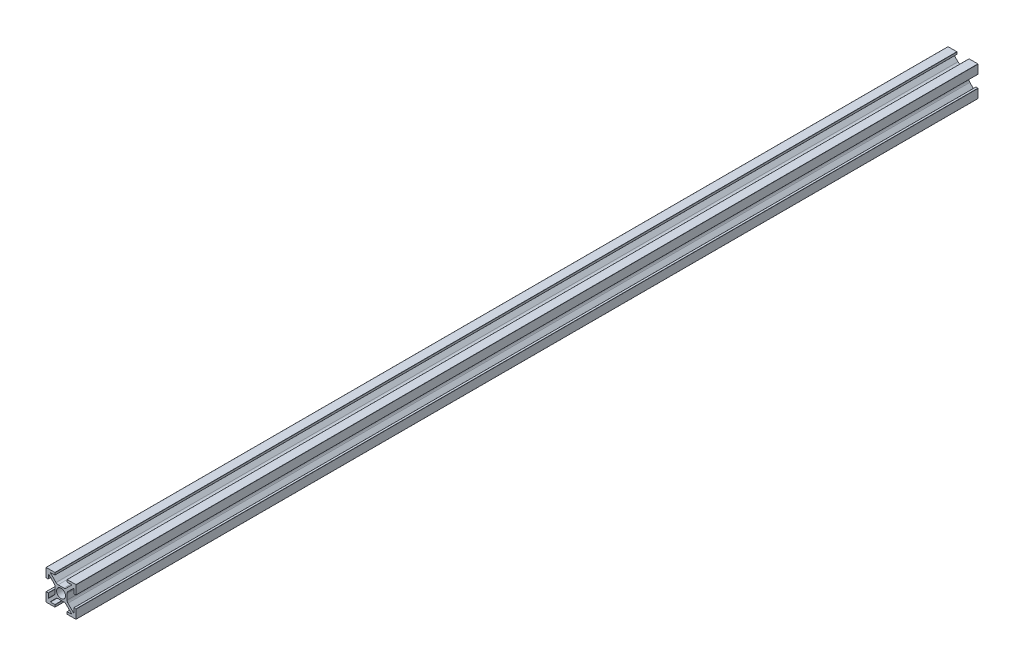
from build123d import *

# Parameters (mm, degrees)
SKETCH1_R           = 3
BOSS_EXTRUDE2_DEPTH = 600


with BuildPart() as part:
    # Sketch1 → Boss-Extrude2 (new body)
    with BuildSketch(Plane.XY.offset(60)):
        with BuildLine():
            Line((18.5, 17.008578644), (18.5, 14.1))
            ThreePointArc((18.5, 14.1), (18.529289322, 14.029289322), (18.6, 14))
            Line((18.6, 14), (19.9, 14))
            ThreePointArc((19.9, 14), (19.970710678, 14.029289322), (20, 14.1))
            Line((20, 14.1), (20, 19.9))
            ThreePointArc((20, 19.9), (19.970710678, 19.970710678), (19.9, 20))
            Line((19.9, 20), (14.1, 20))
            ThreePointArc((14.1, 20), (14.029289322, 19.970710678), (14, 19.9))
            Line((14, 19.9), (14, 18.6))
            ThreePointArc((14, 18.6), (14.029289322, 18.529289322), (14.1, 18.5))
            Line((14.1, 18.5), (17.008578644, 18.5))
            ThreePointArc((17.008578644, 18.5), (17.100966597, 18.438268343), (17.079289322, 18.329289322))
            Line((17.079289322, 18.329289322), (13.335786438, 14.585786438))
            ThreePointArc((13.335786438, 14.585786438), (12.68693974, 14.152240935), (11.921572875, 14))
            Line((11.921572875, 14), (8.078427125, 14))
            ThreePointArc((8.078427125, 14), (7.31306026, 14.152240935), (6.664213562, 14.585786438))
            Line((6.664213562, 14.585786438), (2.920710678, 18.329289322))
            ThreePointArc((2.920710678, 18.329289322), (2.899033403, 18.438268343), (2.991421356, 18.5))
            Line((2.991421356, 18.5), (5.9, 18.5))
            ThreePointArc((5.9, 18.5), (5.970710678, 18.529289322), (6, 18.6))
            Line((6, 18.6), (6, 19.9))
            ThreePointArc((6, 19.9), (5.970710678, 19.970710678), (5.9, 20))
            Line((5.9, 20), (0.1, 20))
            ThreePointArc((0.1, 20), (0.029289322, 19.970710678), (0, 19.9))
            Line((0, 19.9), (0, 14.1))
            ThreePointArc((0, 14.1), (0.029289322, 14.029289322), (0.1, 14))
            Line((0.1, 14), (1.4, 14))
            ThreePointArc((1.4, 14), (1.470710678, 14.029289322), (1.5, 14.1))
            Line((1.5, 14.1), (1.5, 17.008578644))
            ThreePointArc((1.5, 17.008578644), (1.561731657, 17.100966597), (1.670710678, 17.079289322))
            Line((1.670710678, 17.079289322), (5.414213562, 13.335786438))
            ThreePointArc((5.414213562, 13.335786438), (5.847759065, 12.68693974), (6, 11.921572875))
            Line((6, 11.921572875), (6, 8.078427125))
            ThreePointArc((6, 8.078427125), (5.847759065, 7.31306026), (5.414213562, 6.664213562))
            Line((5.414213562, 6.664213562), (1.670710678, 2.920710678))
            ThreePointArc((1.670710678, 2.920710678), (1.561731657, 2.899033403), (1.5, 2.991421356))
            Line((1.5, 2.991421356), (1.5, 5.9))
            ThreePointArc((1.5, 5.9), (1.470710678, 5.970710678), (1.4, 6))
            Line((1.4, 6), (0.1, 6))
            ThreePointArc((0.1, 6), (0.029289322, 5.970710678), (0, 5.9))
            Line((0, 5.9), (0, 0.1))
            ThreePointArc((0, 0.1), (0.029289322, 0.029289322), (0.1, 0))
            Line((0.1, 0), (5.9, 0))
            ThreePointArc((5.9, 0), (5.970710678, 0.029289322), (6, 0.1))
            Line((6, 0.1), (6, 1.4))
            ThreePointArc((6, 1.4), (5.970710678, 1.470710678), (5.9, 1.5))
            Line((5.9, 1.5), (2.991421356, 1.5))
            ThreePointArc((2.991421356, 1.5), (2.899033403, 1.561731657), (2.920710678, 1.670710678))
            Line((2.920710678, 1.670710678), (6.664213562, 5.414213562))
            ThreePointArc((6.664213562, 5.414213562), (7.31306026, 5.847759065), (8.078427125, 6))
            Line((8.078427125, 6), (11.921572875, 6))
            ThreePointArc((11.921572875, 6), (12.68693974, 5.847759065), (13.335786438, 5.414213562))
            Line((13.335786438, 5.414213562), (17.079289322, 1.670710678))
            ThreePointArc((17.079289322, 1.670710678), (17.100966597, 1.561731657), (17.008578644, 1.5))
            Line((17.008578644, 1.5), (14.1, 1.5))
            ThreePointArc((14.1, 1.5), (14.029289322, 1.470710678), (14, 1.4))
            Line((14, 1.4), (14, 0.1))
            ThreePointArc((14, 0.1), (14.029289322, 0.029289322), (14.1, 0))
            Line((14.1, 0), (19.9, 0))
            ThreePointArc((19.9, 0), (19.970710678, 0.029289322), (20, 0.1))
            Line((20, 0.1), (20, 5.9))
            ThreePointArc((20, 5.9), (19.970710678, 5.970710678), (19.9, 6))
            Line((19.9, 6), (18.6, 6))
            ThreePointArc((18.6, 6), (18.529289322, 5.970710678), (18.5, 5.9))
            Line((18.5, 5.9), (18.5, 2.991421356))
            ThreePointArc((18.5, 2.991421356), (18.438268343, 2.899033403), (18.329289322, 2.920710678))
            Line((18.329289322, 2.920710678), (14.585786438, 6.664213562))
            ThreePointArc((14.585786438, 6.664213562), (14.152240935, 7.31306026), (14, 8.078427125))
            Line((14, 8.078427125), (14, 11.921572875))
            ThreePointArc((14, 11.921572875), (14.152240935, 12.68693974), (14.585786438, 13.335786438))
            Line((14.585786438, 13.335786438), (18.329289322, 17.079289322))
            ThreePointArc((18.329289322, 17.079289322), (18.438268343, 17.100966597), (18.5, 17.008578644))
        make_face()
        with Locations(Location((10, 10, 0), (0, 0, 180))):
            Circle(SKETCH1_R, mode=Mode.SUBTRACT)
    extrude(amount=BOSS_EXTRUDE2_DEPTH)


solid = part.part
